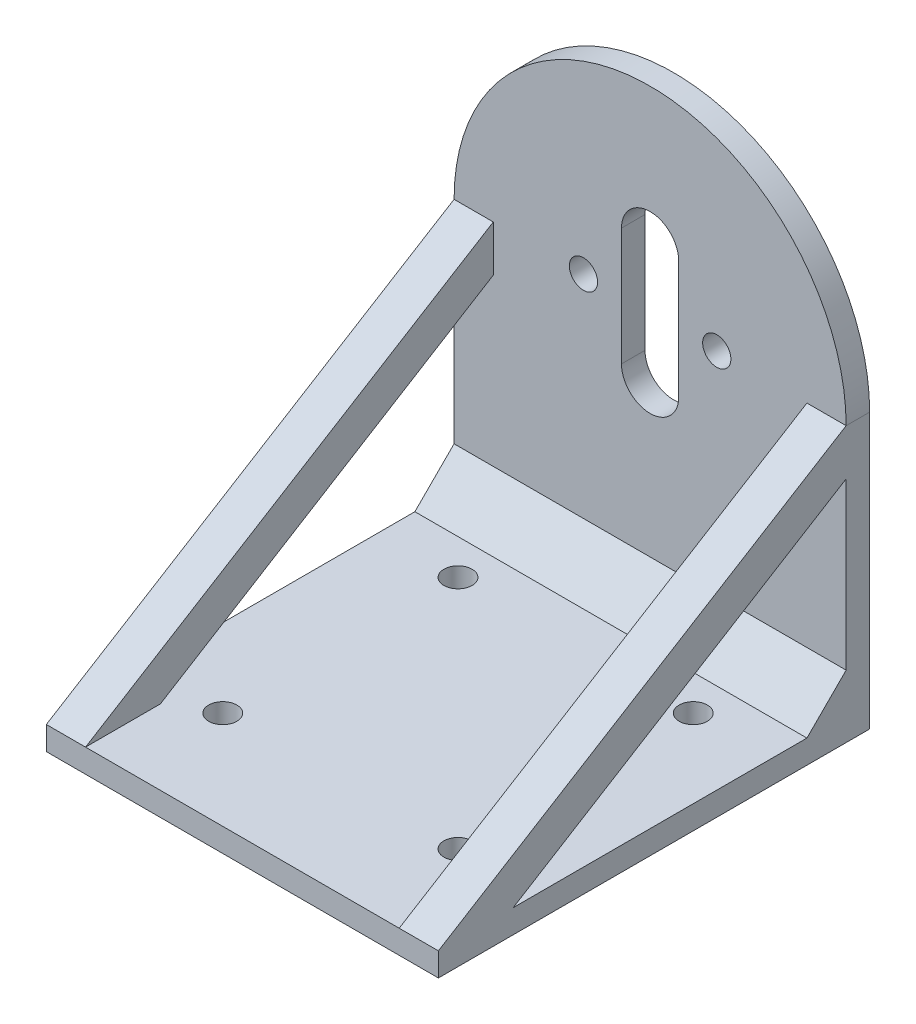
from build123d import *

# Parameters (mm, degrees)
SKETCH5_R                            = 1.8
BOSS_EXTRUDE2_DEPTH                  = 3
SKETCH6_W                            = 50
SKETCH6_H                            = 55
BOSS_EXTRUDE3_DEPTH                  = 3
M3_3_6MM_D                           = 3.6
MIRROR1_AT_THE_SECOND_PLANE_COPY_1_D = 3.6
BOSS_EXTRUDE4_DEPTH                  = 5
CHAMFER1_SIZE                        = 5


with BuildPart() as part:
    # Sketch5 → Boss-Extrude2 (new body)
    with BuildSketch(Plane.XY):
        with BuildLine():
            Line((0, 0), (0, 35))
            ThreePointArc((0, 35), (25, 60), (50, 35))
            Line((50, 35), (50, 0))
            Line((50, 0), (0, 0))
        make_face()
        with Locations((16.5, 35)):
            Circle(SKETCH5_R, mode=Mode.SUBTRACT)
        with Locations((33.5, 35)):
            Circle(SKETCH5_R, mode=Mode.SUBTRACT)
        with BuildLine():
            Line((28.65, 42.5), (28.65, 27.5))
            ThreePointArc((28.65, 27.5), (25, 23.85), (21.35, 27.5))
            Line((21.35, 27.5), (21.35, 42.5))
            ThreePointArc((21.35, 42.5), (25, 46.15), (28.65, 42.5))
        make_face(mode=Mode.SUBTRACT)
    extrude(amount=BOSS_EXTRUDE2_DEPTH)

    # Sketch6 → Boss-Extrude3 (add)
    with BuildSketch(Plane.XZ):
        with Locations((25, 27.5)):
            Rectangle(SKETCH6_W, SKETCH6_H)
    extrude(amount=-BOSS_EXTRUDE3_DEPTH)

    # M3, 3.6mm (through all)
    with Locations(Plane.XZ):
        with Locations((10, 42.5)):
            m3_3_6mm = Hole(M3_3_6MM_D / 2)

    # Mirror1: M3, 3.6mm across plane
    add(m3_3_6mm.mirror(Plane.ZY.offset(-25)), mode=Mode.SUBTRACT)

    # Mirror1 at the second plane: M3, 3.6mm across plane
    add(m3_3_6mm.mirror(Plane.XY.offset(27.5)), mode=Mode.SUBTRACT)

    # Mirror1 at the second plane copy 1 (through all)
    with Locations(Plane(origin=(50, 0, 55), x_dir=(-1, 0, 0), z_dir=(0, -1, 0))):
        with Locations((10, 42.5)):
            Hole(MIRROR1_AT_THE_SECOND_PLANE_COPY_1_D / 2)

    # Sketch10 → Boss-Extrude4 (add)
    with BuildSketch(Plane(origin=(50, 0, 0), x_dir=(0, 0, -1), z_dir=(1, 0, 0))):
        Polygon((-3, 35), (-55, 3), (-45.459789048, 3), (-3, 29.129100953), align=None)
    boss_extrude4 = extrude(amount=-BOSS_EXTRUDE4_DEPTH)

    # Mirror2: Boss-Extrude4 across plane
    add(boss_extrude4.mirror(Plane.ZY.offset(-25)))

    # Chamfer1
    chamfer1_edges = [part.edges().sort_by_distance(p)[0] for p in [
        (25, 3, 3),
    ]]
    chamfer(chamfer1_edges, length=CHAMFER1_SIZE)


solid = part.part
